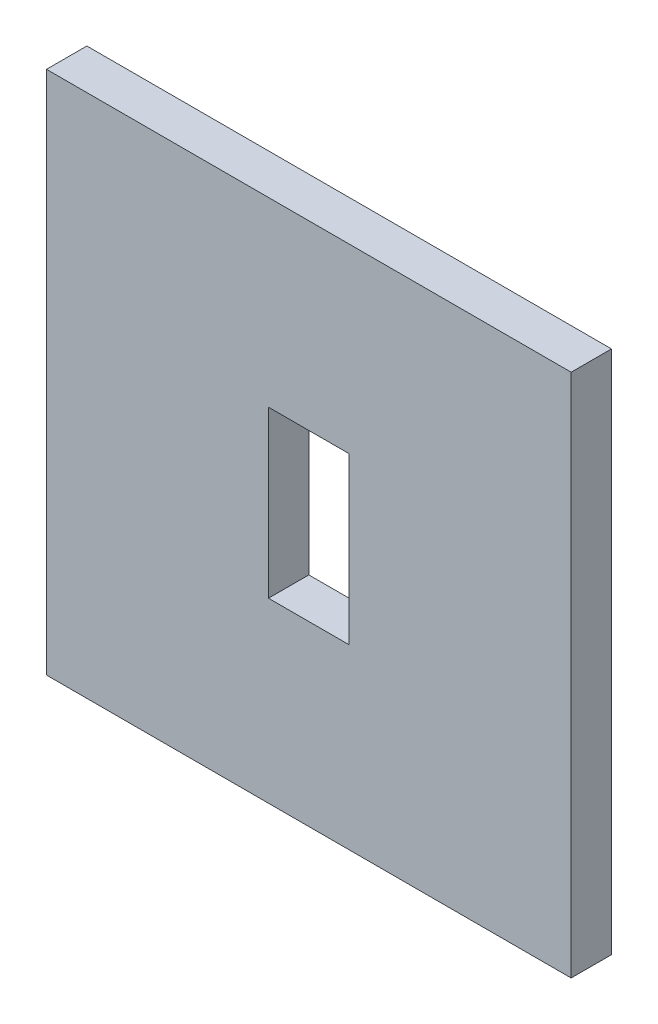
from build123d import *

# Parameters (mm, degrees)
ESQUISSE1_W             = 130
ESQUISSE1_H             = 130
BOSS_EXTRU_1_DEPTH      = 10
ESQUISSE2_W             = 20
ESQUISSE2_H             = 41
ENL_V_MAT_EXTRU_1_DEPTH = 10


with BuildPart() as part:
    # Esquisse1 → Boss.-Extru.1 (new body)
    with BuildSketch(Plane.XY):
        with Locations((65, -65)):
            Rectangle(ESQUISSE1_W, ESQUISSE1_H)
    extrude(amount=BOSS_EXTRU_1_DEPTH)

    # Esquisse2 → Enlèv. mat.-Extru.1 (cut)
    with BuildSketch(Plane.XY.offset(10)):
        with Locations((65, -65.5)):
            Rectangle(ESQUISSE2_W, ESQUISSE2_H)
    extrude(amount=-ENL_V_MAT_EXTRU_1_DEPTH, mode=Mode.SUBTRACT)


solid = part.part
